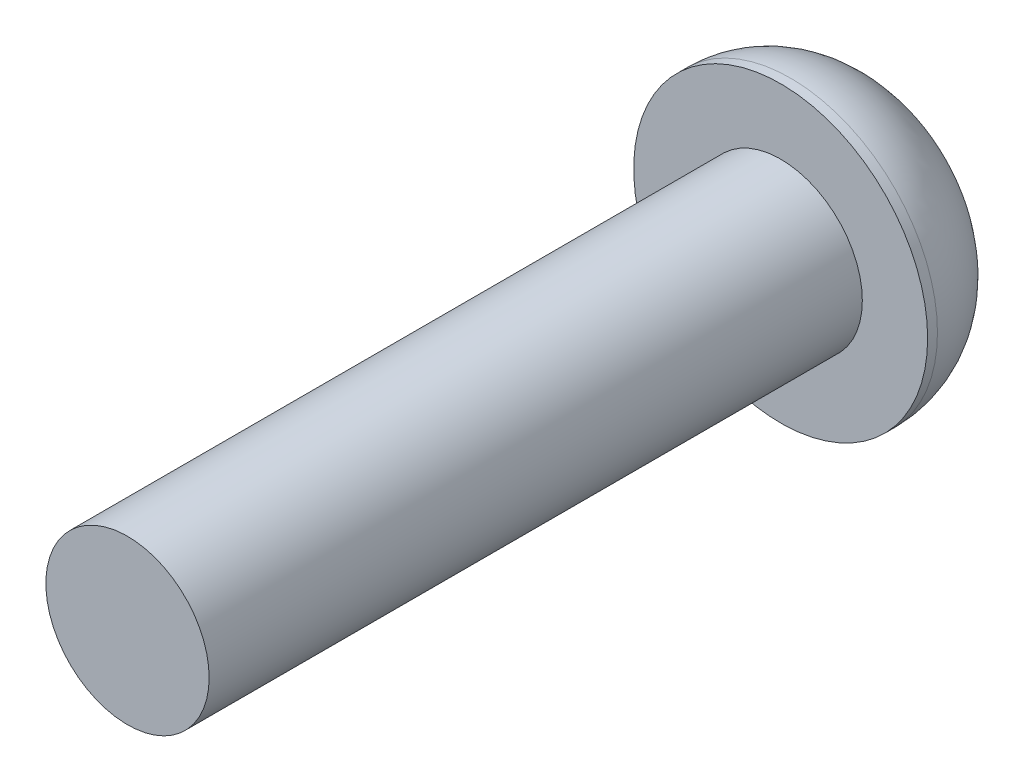
from build123d import *

# Parameters (mm, degrees)
SKETCH_1_R          = 4.5
EXTRUDE_1_DEPTH     = 3.3
SKETCH_2_R          = 2.5
EXTRUDE_2_DEPTH     = 20
FILLET_2_R          = 3
SKETCH_3_W          = 2
SKETCH_3_H          = 2
CUT_EXTRUDE_1_DEPTH = 3


with BuildPart() as part:
    # ｽｹｯﾁ1 → ﾎﾞｽ - 押し出し1 (new body)
    with BuildSketch(Plane.XY):
        Circle(SKETCH_1_R)
    extrude(amount=EXTRUDE_1_DEPTH)

    # ｽｹｯﾁ2 → ﾎﾞｽ - 押し出し2 (add)
    with BuildSketch(Plane.XY.offset(3.3)):
        Circle(SKETCH_2_R)
    extrude(amount=EXTRUDE_2_DEPTH)

    # ﾌｨﾚｯﾄ2
    fillet_2_edges = [part.edges().sort_by_distance(p)[0] for p in [
        (-4.5, 0, 0),
    ]]
    fillet(fillet_2_edges, radius=FILLET_2_R)

    # ｽｹｯﾁ3 → ｶｯﾄ - 押し出し1 (cut)
    with BuildSketch(Plane(origin=(0, 0, 0), x_dir=(-1, 0, 0), z_dir=(0, 0, -1))):
        with BuildLine():
            Line((-1, 3), (-1, 1.118033989))
            ThreePointArc((-1, 1.118033989), (0, 1.5), (1, 1.118033989))
            Line((1, 1.118033989), (1, 3))
            Line((1, 3), (-1, 3))
        make_face()
        Rectangle(SKETCH_3_W, SKETCH_3_H)
        with BuildLine():
            ThreePointArc((1.5, 0), (1.401258538, -0.535233135), (1.118033989, -1))
            Line((1.118033989, -1), (3, -1))
            Line((3, -1), (3, 1))
            Line((3, 1), (1.118033989, 1))
            ThreePointArc((1.118033989, 1), (1.401258538, 0.535233135), (1.5, 0))
        make_face()
        with BuildLine():
            Line((1, 1), (1, -1))
            Line((1, -1), (1.118033989, -1))
            ThreePointArc((1.118033989, -1), (1.401258538, -0.535233135), (1.5, 0))
            ThreePointArc((1.5, 0), (1.401258538, 0.535233135), (1.118033989, 1))
            Line((1.118033989, 1), (1, 1))
        make_face()
        with BuildLine():
            ThreePointArc((-1.118033989, 1), (-1.5, 0), (-1.118033989, -1))
            Line((-1.118033989, -1), (-1, -1))
            Line((-1, -1), (-1, 1))
            Line((-1, 1), (-1.118033989, 1))
        make_face()
        with BuildLine():
            Line((-3, 1), (-3, -1))
            Line((-3, -1), (-1.118033989, -1))
            ThreePointArc((-1.118033989, -1), (-1.5, 0), (-1.118033989, 1))
            Line((-1.118033989, 1), (-3, 1))
        make_face()
        with BuildLine():
            Line((1, -1), (-1, -1))
            Line((-1, -1), (-1, -1.118033989))
            ThreePointArc((-1, -1.118033989), (0, -1.5), (1, -1.118033989))
            Line((1, -1.118033989), (1, -1))
        make_face()
        with BuildLine():
            ThreePointArc((1, -1.118033989), (0, -1.5), (-1, -1.118033989))
            Line((-1, -1.118033989), (-1, -3))
            Line((-1, -3), (1, -3))
            Line((1, -3), (1, -1.118033989))
        make_face()
        with BuildLine():
            Line((-1, 1.118033989), (-1, 1))
            Line((-1, 1), (1, 1))
            Line((1, 1), (1, 1.118033989))
            ThreePointArc((1, 1.118033989), (0, 1.5), (-1, 1.118033989))
        make_face()
    extrude(amount=-CUT_EXTRUDE_1_DEPTH, mode=Mode.SUBTRACT)


solid = part.part
